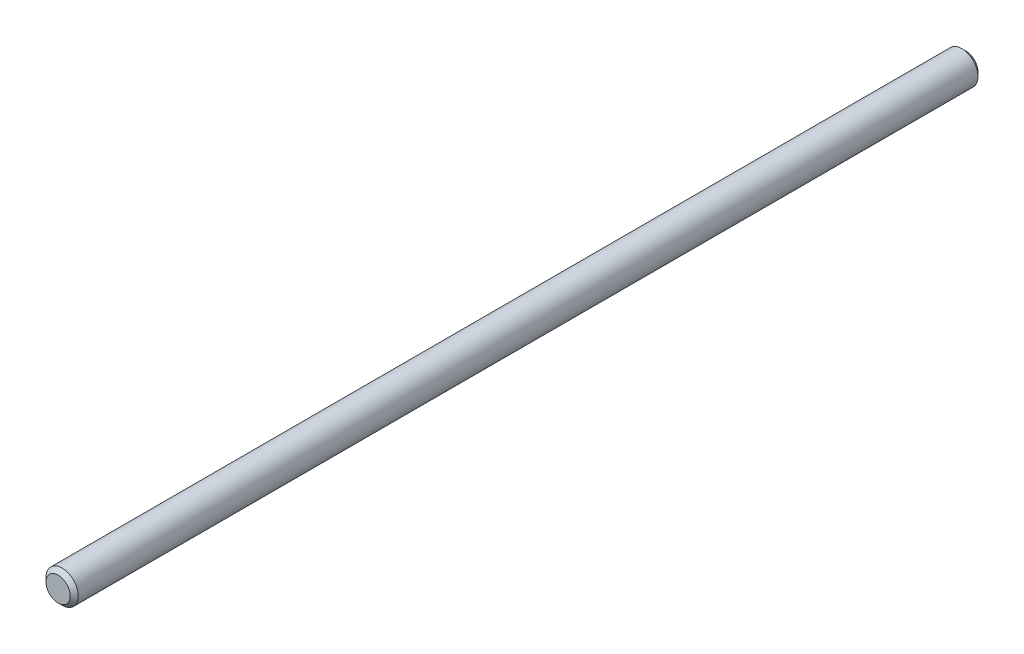
from build123d import *

# Parameters (mm, degrees)
SKETCH1_R           = 4
BOSS_EXTRUDE1_DEPTH = 225
CHAMFER1_SIZE       = 1


with BuildPart() as part:
    # Sketch1 → Boss-Extrude1 (new body)
    with BuildSketch(Plane.XY):
        Circle(SKETCH1_R)
    extrude(amount=BOSS_EXTRUDE1_DEPTH)

    # Chamfer1
    chamfer1_edges = [part.edges().sort_by_distance(p)[0] for p in [
        (-4, 0, 0),
        (-4, 0, 225),
    ]]
    chamfer(chamfer1_edges, length=CHAMFER1_SIZE)


solid = part.part
